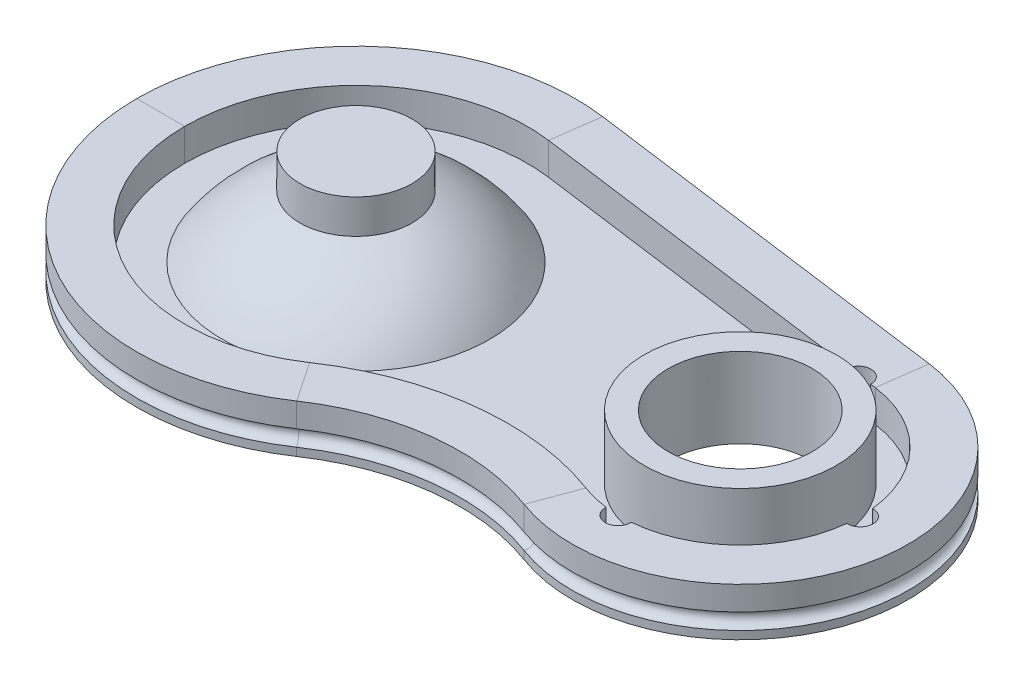
from build123d import *

# Parameters (mm, degrees)
BOSS_EXTRUDE1_START             = 10
BOSS_EXTRUDE1_DEPTH             = 10
SKETCH9_R                       = 45
CUT_EXTRUDE1_DEPTH              = 374.355059021
SKETCH10_R                      = 8
CUT_EXTRUDE2_DEPTH              = 373.416433709
CIRPATTERN1_COUNT               = 2
CIRPATTERN1_ANGLE               = 91
CIRPATTERN1_THE_OTHER_WAY_COUNT = 2
CIRPATTERN1_THE_OTHER_WAY_ANGLE = 91
SKETCH13_R                      = 60
CUT_EXTRUDE3_DEPTH              = 374.355059021


with BuildPart() as part:
    # Sweep1: sweep along a path in Sketch2
    with BuildLine(Plane(origin=(0, 0, 0), x_dir=(1, 0, 0), z_dir=(0, 1, 0))) as sweep1_path:
        Line((254, 104.062481231), (18.266666667, 135.776761226))
        ThreePointArc((18.266666667, 135.776761226), (-133.403835599, -31.183595805), (76.561732852, -113.610303506))
        ThreePointArc((76.561732852, -113.610303506), (138.192055313, -90.696999263), (203.485714286, -98.446467376))
        ThreePointArc((203.485714286, -98.446467376), (341.878318752, -25.412756014), (254, 104.062481231))
    # Sketch3 → Sweep1 (sweep)
    with BuildSketch(Plane.XY):
        with BuildLine():
            Line((-107, 0), (-137, 0))
            Line((-137, 0), (-137, 5))
            ThreePointArc((-137, 5), (-132, 10), (-137, 15))
            Line((-137, 15), (-137, 30))
            Line((-137, 30), (-107, 30))
            Line((-107, 30), (-107, 0))
        make_face()
    sweep(path=sweep1_path.line)

    # Sketch7 → Boss-Extrude1 (add)
    with BuildSketch(Plane(origin=(0, 0, 0), x_dir=(1, 0, 0), z_dir=(0, 1, 0)).offset(BOSS_EXTRUDE1_START)):
        with BuildLine():
            Line((250, 74.330343737), (14.266666667, 106.044623731))
            ThreePointArc((14.266666667, 106.044623731), (-70.436022981, 80.54667384), (-107, 0))
            ThreePointArc((-107, 0), (-50.25328985, -94.464844568), (59.796389892, -88.732134855))
            ThreePointArc((59.796389892, -88.732134855), (134.633210023, -60.908836845), (213.918367347, -70.318905268))
            ThreePointArc((213.918367347, -70.318905268), (312.77022768, -18.151968581), (250, 74.330343737))
        make_face()
    extrude(amount=-BOSS_EXTRUDE1_DEPTH)

    # Sketch8 → Revolve1 (revolve)
    with BuildSketch(Plane(origin=(240, 0, 0), x_dir=(0, 0, -1), z_dir=(1, 0, 0))):
        Polygon((35, 0), (35, 10), (45, 10), (45, 50), (60, 50), (60, 0), align=None)
    revolve(axis=Axis((240, 0, 0), (0, 1, 0)))

    # Sketch9 → Cut-Extrude1 (cut, through all)
    with BuildSketch(Plane(origin=(0, 10, 0), x_dir=(1, 0, 0), z_dir=(0, 1, 0))):
        with Locations(Location((240, 0, 0), (0, 0, 90))):
            Circle(SKETCH9_R)
    extrude(amount=-CUT_EXTRUDE1_DEPTH, mode=Mode.SUBTRACT)

    # Sketch10 → Cut-Extrude2 (cut, through all)
    with BuildSketch(Plane(origin=(0, 30, 0), x_dir=(1, 0, 0), z_dir=(0, 1, 0))):
        with Locations(Location((315, 0, 0), (0, 0, 270))):
            Circle(SKETCH10_R)
    cut_extrude2 = extrude(amount=-CUT_EXTRUDE2_DEPTH, mode=Mode.SUBTRACT)

    # CirPattern1: Cut-Extrude2 ×2 about axis
    cirpattern1_axis = Axis((240, 10, 0), (0, 1, 0))
    for i in range(1, CIRPATTERN1_COUNT):
        add(cut_extrude2.rotate(cirpattern1_axis, i * CIRPATTERN1_ANGLE / (CIRPATTERN1_COUNT - 1)), mode=Mode.SUBTRACT)

    # CirPattern1 the other way: Cut-Extrude2 ×2 about axis
    cirpattern1_the_other_way_axis = Axis((240, 10, 0), (0, -1, 0))
    for i in range(1, CIRPATTERN1_THE_OTHER_WAY_COUNT):
        add(cut_extrude2.rotate(cirpattern1_the_other_way_axis, i * CIRPATTERN1_THE_OTHER_WAY_ANGLE / (CIRPATTERN1_THE_OTHER_WAY_COUNT - 1)), mode=Mode.SUBTRACT)

    # Sketch13 → Cut-Extrude3 (cut, through all)
    with BuildSketch(Plane(origin=(0, 10, 0), x_dir=(1, 0, 0), z_dir=(0, 1, 0))):
        with Locations(Location((0, 0, 0), (0, 0, 270))):
            Circle(SKETCH13_R)
    extrude(amount=-CUT_EXTRUDE3_DEPTH, mode=Mode.SUBTRACT)


with BuildPart() as body_2:
    # Sketch12 → Revolve4 (revolve)
    with BuildSketch(Plane(origin=(0, 0, 0), x_dir=(0, 0, -1), z_dir=(1, 0, 0))):
        with BuildLine():
            Line((60, 10), (60, 22.082039325))
            ThreePointArc((60, 22.082039325), (32.108581693, 39.077577163), (-0.011574567, 44.999999256))
            Line((-0.011574567, 44.999999256), (0, 70))
            Line((0, 70), (35, 70))
            Line((35, 70), (35, 48.674969976))
            ThreePointArc((35, 48.674969976), (62.33359023, 33.19541885), (83.516465442, 10))
            Line((83.516465442, 10), (60, 10))
        make_face()
    revolve(axis=Axis((0, 44.999999256, 0.011574567), (0, 0.9999998928235381, -0.0004629826265872942)))


solid = Compound([part.part, body_2.part])
